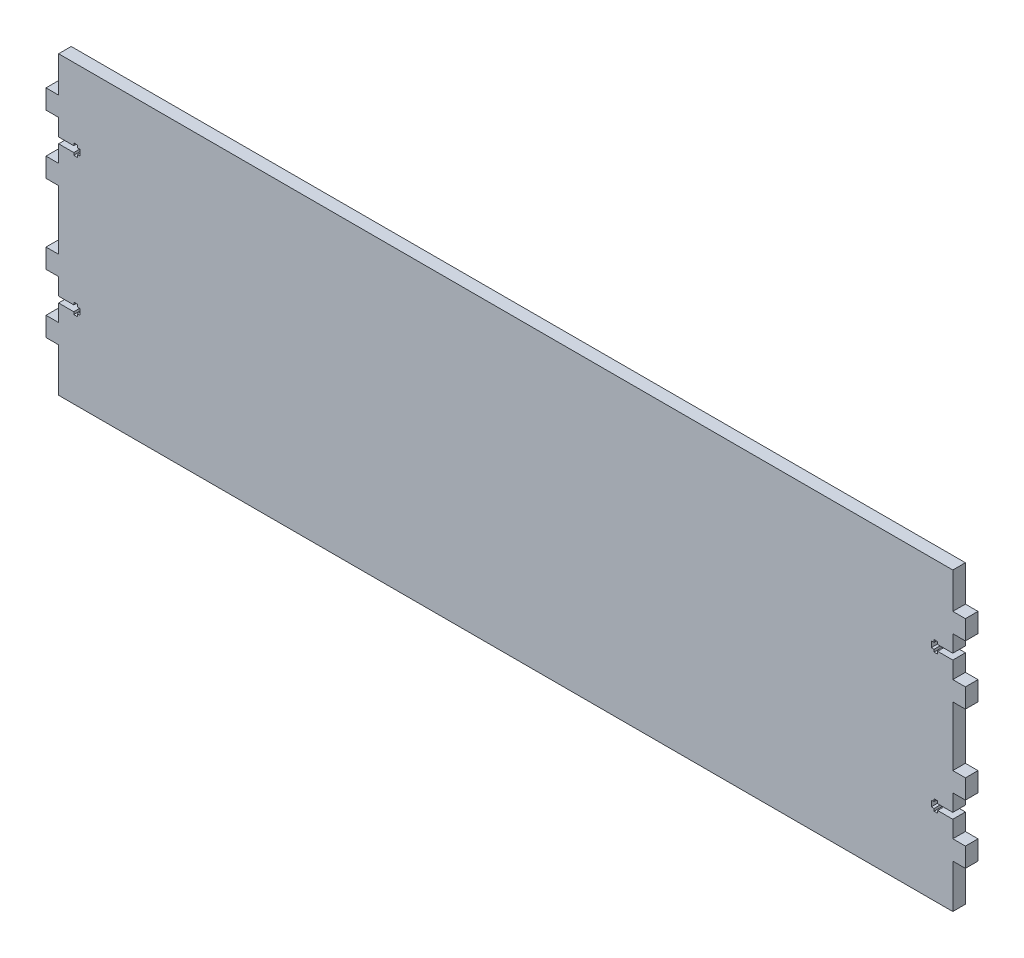
from build123d import *

# Parameters (mm, degrees)
BOSS_EXTRUDE1_DEPTH = 6.4


with BuildPart() as part:
    # Sketch1 → Boss-Extrude1 (new body)
    with BuildSketch(Plane.XY):
        Polygon((0, 146.1), (0, 127.9), (-6.4, 127.9), (-6.4, 118.1), (0, 118.1), (0, 109.500679587), (7.7, 109.500679587), (7.7, 110.750679587), (9.5, 110.750679587), (9.5, 109.500679587), (10.9, 109.500679587), (10.9, 106.499320413), (9.5, 106.499320413), (9.5, 105.250679587), (7.7, 105.250679587), (7.7, 106.499320413), (0, 106.499320413), (0, 97.9), (-6.4, 97.9), (-6.4, 88.1), (0, 88.1), (0, 57.9), (-6.4, 57.9), (-6.4, 48.1), (0, 48.1), (0, 39.500679587), (7.7, 39.500679587), (7.7, 40.750679587), (9.5, 40.750679587), (9.5, 39.500679587), (10.9, 39.500679587), (10.9, 36.499320413), (9.5, 36.499320413), (9.5, 35.250679587), (7.7, 35.250679587), (7.7, 36.499320413), (0, 36.499320413), (0, 27.9), (-6.4, 27.9), (-6.4, 18.1), (0, 18.1), (0, -4.09), (454, -4.09), (454, 18.1), (460.4, 18.1), (460.4, 27.9), (454, 27.9), (454, 36.499320413), (446.3, 36.499320413), (446.3, 35.250679587), (444.5, 35.250679587), (444.5, 36.499320413), (443.1, 36.499320413), (443.1, 39.500679587), (444.5, 39.500679587), (444.5, 40.750679587), (446.3, 40.750679587), (446.3, 39.500679587), (454, 39.500679587), (454, 48.1), (460.4, 48.1), (460.4, 57.9), (454, 57.9), (454, 88.1), (460.4, 88.1), (460.4, 97.9), (454, 97.9), (454, 106.499320413), (446.3, 106.499320413), (446.3, 105.250679587), (444.5, 105.250679587), (444.5, 106.499320413), (443.1, 106.499320413), (443.1, 109.500679587), (444.5, 109.500679587), (444.5, 110.750679587), (446.3, 110.750679587), (446.3, 109.500679587), (454, 109.500679587), (454, 118.1), (460.4, 118.1), (460.4, 127.9), (454, 127.9), (454, 146.1), align=None)
    extrude(amount=BOSS_EXTRUDE1_DEPTH)


solid = part.part
